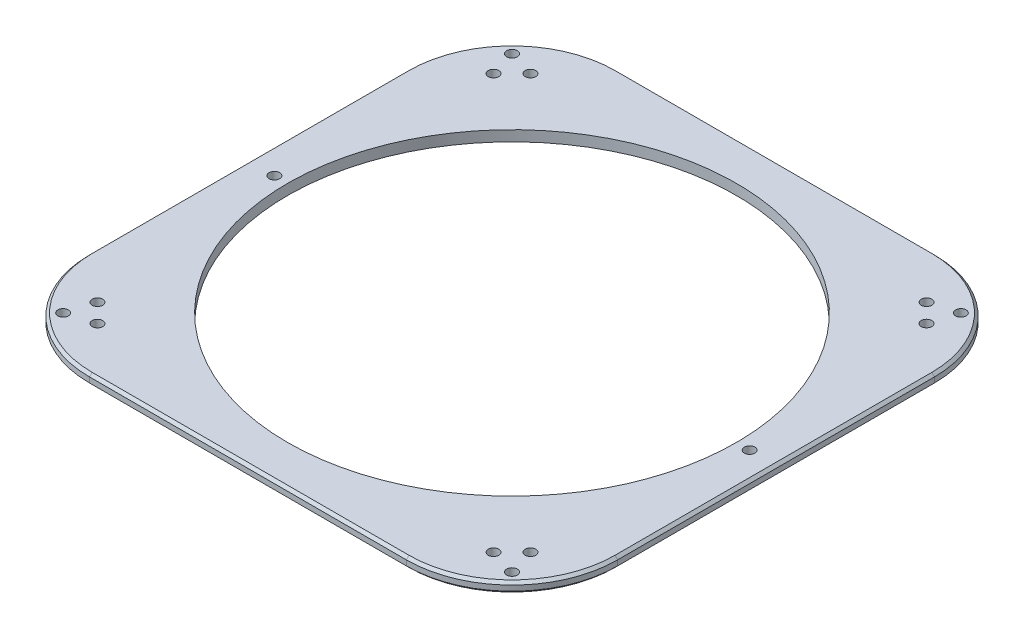
from build123d import *

# Parameters (mm, degrees)
SKETCH_1_W      = 200
SKETCH_1_H      = 200
SKETCH_1_R      = 2
SKETCH_1_R_2    = 85
EXTRUDE_1_DEPTH = 4
FILLET_1_R      = 40
CHAMFER_1_SIZE  = 1


with BuildPart() as part:
    # Эскиз1 → Бобышка-Вытянуть1 (new body)
    with BuildSketch(Plane(origin=(0, 0, 0), x_dir=(1, 0, 0), z_dir=(0, 1, 0))):
        Rectangle(SKETCH_1_W, SKETCH_1_H)
        with Locations(Location((-85, 85, 0), (0, 0, 270))):
            Circle(SKETCH_1_R, mode=Mode.SUBTRACT)
        with Locations(Location((85, 85, 0), (0, 0, 270))):
            Circle(SKETCH_1_R, mode=Mode.SUBTRACT)
        with Locations(Location((85, -85, 0), (0, 0, 270))):
            Circle(SKETCH_1_R, mode=Mode.SUBTRACT)
        with Locations(Location((-85, -85, 0), (0, 0, 270))):
            Circle(SKETCH_1_R, mode=Mode.SUBTRACT)
        with Locations(Location((-90, 0, 0), (0, 0, 270))):
            Circle(SKETCH_1_R, mode=Mode.SUBTRACT)
        with Locations(Location((90, 0, 0), (0, 0, 90))):
            Circle(SKETCH_1_R, mode=Mode.SUBTRACT)
        with Locations(Location((75, 82, 0), (0, 0, 270))):
            Circle(SKETCH_1_R, mode=Mode.SUBTRACT)
        with Locations(Location((-75, 82, 0), (0, 0, 270))):
            Circle(SKETCH_1_R, mode=Mode.SUBTRACT)
        with Locations(Location((75, -82, 0), (0, 0, 270))):
            Circle(SKETCH_1_R, mode=Mode.SUBTRACT)
        with Locations(Location((-75, -82, 0), (0, 0, 270))):
            Circle(SKETCH_1_R, mode=Mode.SUBTRACT)
        with Locations(Location((82, -75, 0), (0, 0, 270))):
            Circle(SKETCH_1_R, mode=Mode.SUBTRACT)
        with Locations(Location((-82, -75, 0), (0, 0, 270))):
            Circle(SKETCH_1_R, mode=Mode.SUBTRACT)
        with Locations(Location((-82, 75, 0), (0, 0, 270))):
            Circle(SKETCH_1_R, mode=Mode.SUBTRACT)
        with Locations(Location((81.987312617, 75.001883036, 0), (0, 0, 270))):
            Circle(SKETCH_1_R, mode=Mode.SUBTRACT)
        with Locations(Location((0, 0, 0), (0, 0, 270))):
            Circle(SKETCH_1_R_2, mode=Mode.SUBTRACT)
    extrude(amount=EXTRUDE_1_DEPTH)

    # Скругление1
    fillet_1_edges = [part.edges().sort_by_distance(p)[0] for p in [
        (100, 2, 100),
        (-100, 2, 100),
        (-100, 2, -100),
        (100, 2, -100),
    ]]
    fillet(fillet_1_edges, radius=FILLET_1_R)

    # Фаска1
    chamfer_1_edges = [part.edges().sort_by_distance(p)[0] for p in [
        (-100, 0, 0),
        (-100, 4, 0),
        (100, 0, 0),
        (0, 0, 100),
        (0, 0, -100),
        (88.284271247, 0, 88.284271247),
        (88.284271247, 0, -88.284271247),
        (-88.284271247, 0, 88.284271247),
        (-88.284271247, 0, -88.284271247),
        (0, 4, -100),
        (100, 4, 0),
        (0, 4, 100),
        (88.284271247, 4, 88.284271247),
        (88.284271247, 4, -88.284271247),
        (-88.284271247, 4, 88.284271247),
        (-88.284271247, 4, -88.284271247),
    ]]
    chamfer(chamfer_1_edges, length=CHAMFER_1_SIZE)


solid = part.part
